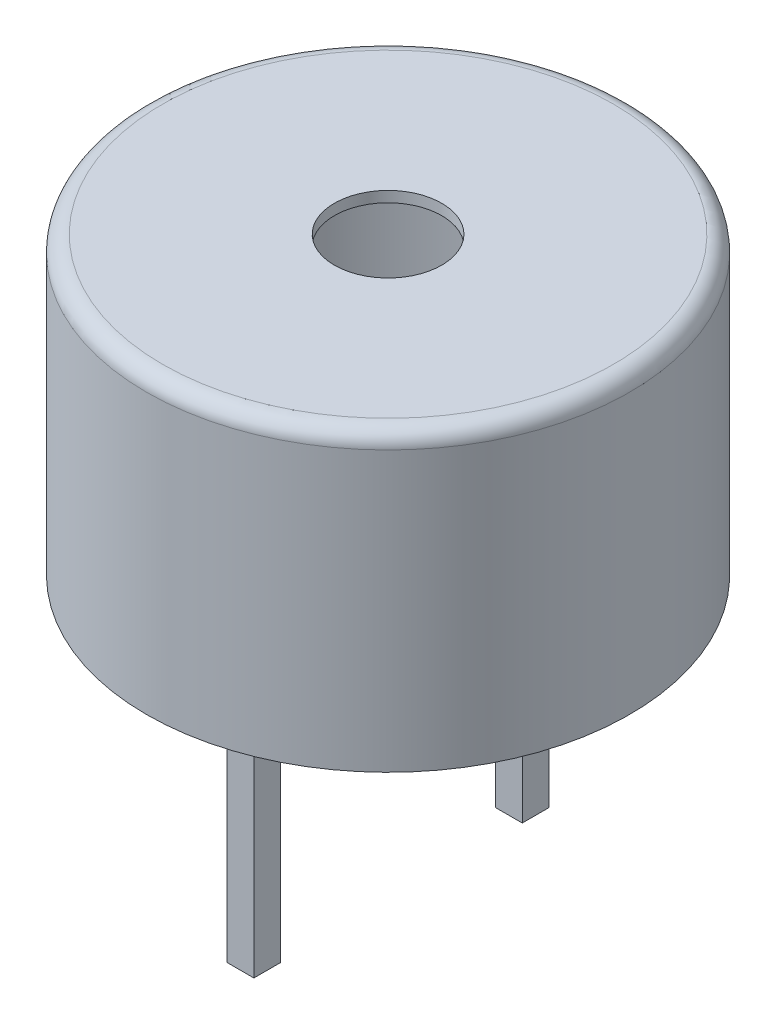
from build123d import *

# Parameters (mm, degrees)
CROQUIS1_R              = 4.5
SALIENTE_EXTRUIR1_DEPTH = 1
CROQUIS2_R              = 4.5
CROQUIS2_R_2            = 3.5
SALIENTE_EXTRUIR2_DEPTH = 4.5
CROQUIS3_R              = 2.296416316
SALIENTE_EXTRUIR3_DEPTH = 2
SALIENTE_EXTRUIR4_START = -0.2
CROQUIS4_R              = 4.5
CROQUIS4_R_2            = 1
SALIENTE_EXTRUIR4_DEPTH = 0.2
CROQUIS5_W              = 0.5
CROQUIS5_H              = 0.5
SALIENTE_EXTRUIR5_DEPTH = 5
REDONDEO1_R             = 0.3


with BuildPart() as part:
    # Croquis1 → Saliente-Extruir1 (new body)
    with BuildSketch(Plane(origin=(0, 0, 0), x_dir=(1, 0, 0), z_dir=(0, 1, 0))):
        with Locations(Location((0, 0, 0), (0, 0, 270))):
            Circle(CROQUIS1_R)
    extrude(amount=SALIENTE_EXTRUIR1_DEPTH)

    # Croquis2 → Saliente-Extruir2 (add)
    with BuildSketch(Plane(origin=(0, 1, 0), x_dir=(1, 0, 0), z_dir=(0, 1, 0))):
        with Locations(Location((0, 0, 0), (0, 0, 270))):
            Circle(CROQUIS2_R)
        with Locations(Location((0, 0, 0), (0, 0, 270))):
            Circle(CROQUIS2_R_2, mode=Mode.SUBTRACT)
    extrude(amount=SALIENTE_EXTRUIR2_DEPTH)

    # Croquis3 → Saliente-Extruir3 (add)
    with BuildSketch(Plane(origin=(0, 1, 0), x_dir=(1, 0, 0), z_dir=(0, 1, 0))):
        with Locations(Location((0, 0, 0), (0, 0, 270))):
            Circle(CROQUIS3_R)
    extrude(amount=SALIENTE_EXTRUIR3_DEPTH)

    # Croquis4 → Saliente-Extruir4 (add)
    with BuildSketch(Plane(origin=(0, 5.5, 0), x_dir=(1, 0, 0), z_dir=(0, 1, 0)).offset(SALIENTE_EXTRUIR4_START)):
        with Locations(Location((0, 0, 0), (0, 0, 270))):
            Circle(CROQUIS4_R)
        with Locations(Location((0, 0, 0), (0, 0, 270))):
            Circle(CROQUIS4_R_2, mode=Mode.SUBTRACT)
    extrude(amount=SALIENTE_EXTRUIR4_DEPTH)

    # Croquis5 → Saliente-Extruir5 (add)
    with BuildSketch(Plane.XZ):
        with Locations((0, -2.5)):
            Rectangle(CROQUIS5_W, CROQUIS5_H)
        with Locations((0, 2.5)):
            Rectangle(CROQUIS5_W, CROQUIS5_H)
    extrude(amount=SALIENTE_EXTRUIR5_DEPTH)

    # Redondeo1
    redondeo1_edges = [part.edges().sort_by_distance(p)[0] for p in [
        (0, 5.5, -4.5),
    ]]
    fillet(redondeo1_edges, radius=REDONDEO1_R)


solid = part.part
